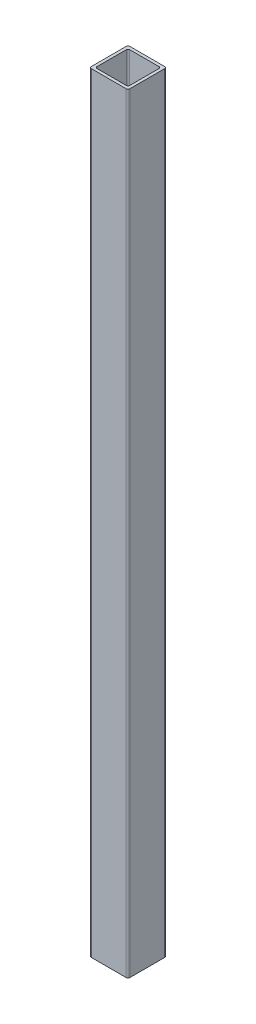
from build123d import *

# Parameters (mm, degrees)
SQUARE_TUBE_2_5X2_5X_188_A500_1_DEPTH = 1270


with BuildPart() as part:
    # Sketch11 → Square tube 2.5X2.5X.188 A500(1) (new body)
    with BuildSketch(Plane(origin=(0, 0, 0), x_dir=(-1, 0, 0), z_dir=(0, 1, 0))):
        with BuildLine():
            Line((28.575, -31.75), (-28.575, -31.75))
            ThreePointArc((-28.575, -31.75), (-30.82006403, -30.82006403), (-31.75, -28.575))
            Line((-31.75, -28.575), (-31.75, 28.575))
            ThreePointArc((-31.75, 28.575), (-30.82006403, 30.82006403), (-28.575, 31.75))
            Line((-28.575, 31.75), (28.575, 31.75))
            ThreePointArc((28.575, 31.75), (30.82006403, 30.82006403), (31.75, 28.575))
            Line((31.75, 28.575), (31.75, -28.575))
            ThreePointArc((31.75, -28.575), (30.82006403, -30.82006403), (28.575, -31.75))
        make_face()
        with BuildLine():
            Line((24.27732, 26.9748), (-24.27732, 26.9748))
            ThreePointArc((-24.27732, 26.9748), (-26.1847264, 26.1847264), (-26.9748, 24.27732))
            Line((-26.9748, 24.27732), (-26.9748, -24.27732))
            ThreePointArc((-26.9748, -24.27732), (-26.1847264, -26.1847264), (-24.27732, -26.9748))
            Line((-24.27732, -26.9748), (24.27732, -26.9748))
            ThreePointArc((24.27732, -26.9748), (26.1847264, -26.1847264), (26.9748, -24.27732))
            Line((26.9748, -24.27732), (26.9748, 24.27732))
            ThreePointArc((26.9748, 24.27732), (26.1847264, 26.1847264), (24.27732, 26.9748))
        make_face(mode=Mode.SUBTRACT)
    extrude(amount=SQUARE_TUBE_2_5X2_5X_188_A500_1_DEPTH)


solid = part.part
